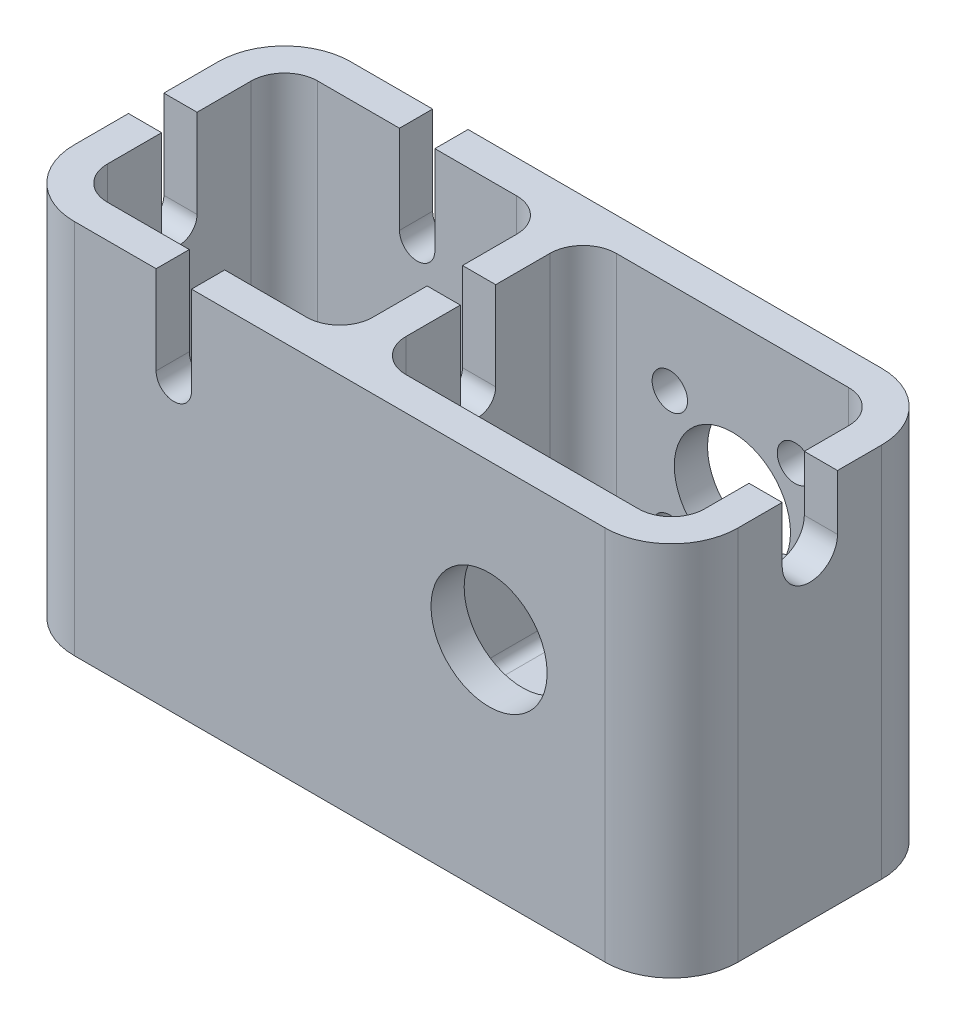
from build123d import *

# Parameters (mm, degrees)
SKETCH1_W           = 60
SKETCH1_H           = 25
BOSS_EXTRUDE1_DEPTH = 4
SKETCH3_R           = 1.6
CUT_EXTRUDE1_DEPTH  = 66.122960621
SKETCH4_W           = 60
SKETCH4_H           = 25
SKETCH4_W_2         = 24
SKETCH4_H_2         = 19
SKETCH4_W_3         = 27
BOSS_EXTRUDE2_DEPTH = 30
SKETCH5_R           = 5.25
CUT_EXTRUDE2_DEPTH  = 74.35529974
CUT_EXTRUDE3_REACH  = 75.355
SKETCH6_R           = 1.6
FILLET3_R           = 3
FILLET4_R           = 1
FILLET5_R           = 6
CUT_EXTRUDE4_DEPTH  = 74.35529974
CUT_EXTRUDE5_REACH  = 75.355
CUT_EXTRUDE6_REACH  = 75.355


with BuildPart() as part:
    # Sketch1 → Boss-Extrude1 (new body)
    with BuildSketch(Plane(origin=(0, 0, 0), x_dir=(1, 0, 0), z_dir=(0, 1, 0))):
        with Locations((30, 12.5)):
            Rectangle(SKETCH1_W, SKETCH1_H)
    extrude(amount=BOSS_EXTRUDE1_DEPTH)

    # Sketch3 → Cut-Extrude1 (cut, through all)
    with BuildSketch(Plane(origin=(0, 4, 0), x_dir=(1, 0, 0), z_dir=(0, 1, 0))):
        with Locations(Location((7.5, 17.5, 0), (0, 0, 270))):
            Circle(SKETCH3_R)
        with Locations(Location((22.5, 17.5, 0), (0, 0, 270))):
            Circle(SKETCH3_R)
        with Locations(Location((22.5, 7.5, 0), (0, 0, 270))):
            Circle(SKETCH3_R)
        with Locations(Location((7.5, 7.5, 0), (0, 0, 270))):
            Circle(SKETCH3_R)
    extrude(amount=-CUT_EXTRUDE1_DEPTH, mode=Mode.SUBTRACT)

    # Sketch4 → Boss-Extrude2 (add)
    with BuildSketch(Plane(origin=(0, 4, 0), x_dir=(1, 0, 0), z_dir=(0, 1, 0))):
        with Locations((30, 12.5)):
            Rectangle(SKETCH4_W, SKETCH4_H)
        with Locations((15, 12.5)):
            Rectangle(SKETCH4_W_2, SKETCH4_H_2, mode=Mode.SUBTRACT)
        with Locations((43.5, 12.5)):
            Rectangle(SKETCH4_W_3, SKETCH4_H_2, mode=Mode.SUBTRACT)
    extrude(amount=BOSS_EXTRUDE2_DEPTH)

    # Sketch5 → Cut-Extrude2 (cut, through all)
    with BuildSketch(Plane(origin=(0, 0, -25), x_dir=(-1, 0, 0), z_dir=(0, 0, -1))):
        with Locations((-43.5, 20)):
            Circle(SKETCH5_R)
    extrude(amount=-CUT_EXTRUDE2_DEPTH, mode=Mode.SUBTRACT)

    # Sketch6 → Cut-Extrude3 (cut, up to next)
    with BuildSketch(Plane(origin=(0, 0, -25), x_dir=(-1, 0, 0), z_dir=(0, 0, -1)), mode=Mode.PRIVATE) as cut_extrude3_sk1:
        with Locations((-37.843145751, 14.343145751)):
            Circle(SKETCH6_R)
    cut_extrude3_tool1 = extrude(cut_extrude3_sk1.sketch, amount=-CUT_EXTRUDE3_REACH, mode=Mode.PRIVATE) & part.part
    # Sketch6 → Cut-Extrude3 (cut, up to next)
    with BuildSketch(Plane(origin=(0, 0, -25), x_dir=(-1, 0, 0), z_dir=(0, 0, -1)), mode=Mode.PRIVATE) as cut_extrude3_sk2:
        with Locations((-49.156854249, 14.343145751)):
            Circle(SKETCH6_R)
    cut_extrude3_tool2 = extrude(cut_extrude3_sk2.sketch, amount=-CUT_EXTRUDE3_REACH, mode=Mode.PRIVATE) & part.part
    # Sketch6 → Cut-Extrude3 (cut, up to next)
    with BuildSketch(Plane(origin=(0, 0, -25), x_dir=(-1, 0, 0), z_dir=(0, 0, -1)), mode=Mode.PRIVATE) as cut_extrude3_sk3:
        with Locations((-49.156854249, 25.656854249)):
            Circle(SKETCH6_R)
    cut_extrude3_tool3 = extrude(cut_extrude3_sk3.sketch, amount=-CUT_EXTRUDE3_REACH, mode=Mode.PRIVATE) & part.part
    # Sketch6 → Cut-Extrude3 (cut, up to next)
    with BuildSketch(Plane(origin=(0, 0, -25), x_dir=(-1, 0, 0), z_dir=(0, 0, -1)), mode=Mode.PRIVATE) as cut_extrude3_sk4:
        with Locations((-37.843145751, 25.656854249)):
            Circle(SKETCH6_R)
    cut_extrude3_tool4 = extrude(cut_extrude3_sk4.sketch, amount=-CUT_EXTRUDE3_REACH, mode=Mode.PRIVATE) & part.part
    add(cut_extrude3_tool1.solids().sort_by_distance((37.843146, 14.343146, -25))[0], mode=Mode.SUBTRACT)
    add(cut_extrude3_tool2.solids().sort_by_distance((49.156854, 14.343146, -25))[0], mode=Mode.SUBTRACT)
    add(cut_extrude3_tool3.solids().sort_by_distance((49.156854, 25.656854, -25))[0], mode=Mode.SUBTRACT)
    add(cut_extrude3_tool4.solids().sort_by_distance((37.843146, 25.656854, -25))[0], mode=Mode.SUBTRACT)

    # Fillet3
    fillet3_edges = [part.edges().sort_by_distance(p)[0] for p in [
        (3, 19, -3),
        (27, 19, -3),
        (27, 19, -22),
        (3, 19, -22),
        (57, 19, -3),
        (57, 19, -22),
        (30, 19, -22),
        (30, 19, -3),
    ]]
    fillet(fillet3_edges, radius=FILLET3_R)

    # Fillet4
    fillet4_edges = [part.edges().sort_by_distance(p)[0] for p in [
        (15, 4, -3),
        (15, 4, -22),
        (3, 4, -12.5),
        (27, 4, -12.5),
        (26.121320344, 4, -21.121320344),
        (3.878679656, 4, -21.121320344),
        (3.878679656, 4, -3.878679656),
        (26.121320344, 4, -3.878679656),
        (30, 4, -12.5),
        (43.5, 4, -3),
        (57, 4, -12.5),
        (43.5, 4, -22),
        (30.878679656, 4, -21.121320344),
        (56.121320344, 4, -21.121320344),
        (56.121320344, 4, -3.878679656),
        (30.878679656, 4, -3.878679656),
    ]]
    fillet(fillet4_edges, radius=FILLET4_R)

    # Fillet5
    fillet5_edges = [part.edges().sort_by_distance(p)[0] for p in [
        (0, 17, -25),
        (60, 17, -25),
        (60, 17, 0),
        (0, 17, 0),
    ]]
    fillet(fillet5_edges, radius=FILLET5_R)

    # Sketch7 → Cut-Extrude4 (cut, through all)
    with BuildSketch(Plane(origin=(0, 0, -25), x_dir=(-1, 0, 0), z_dir=(0, 0, -1))):
        with BuildLine():
            Line((-13.4, 26), (-13.4, 34))
            Line((-13.4, 34), (-16.6, 34))
            Line((-16.6, 34), (-16.6, 26))
            ThreePointArc((-16.6, 26), (-15, 24.4), (-13.4, 26))
        make_face()
    extrude(amount=-CUT_EXTRUDE4_DEPTH, mode=Mode.SUBTRACT)

    # Cut-Extrude5: up to this face of the body (flat: up to its plane)
    cut_extrude5_end = Plane(part.part.faces().sort_by_distance((30, 19.5, -12.5))[0])
    # Sketch8 → Cut-Extrude5 (cut, up to the picked face)
    with BuildSketch(Plane.ZY, mode=Mode.PRIVATE) as cut_extrude5_sk1:
        with BuildLine():
            Line((-14.1, 26), (-14.1, 34))
            Line((-14.1, 34), (-10.9, 34))
            Line((-10.9, 34), (-10.9, 26))
            ThreePointArc((-10.9, 26), (-12.5, 24.4), (-14.1, 26))
        make_face()
    cut_extrude5_tool1 = split(extrude(cut_extrude5_sk1.sketch, amount=-CUT_EXTRUDE5_REACH, mode=Mode.PRIVATE), bisect_by=cut_extrude5_end, keep=Keep.BOTH, mode=Mode.PRIVATE)
    add(cut_extrude5_tool1.solids().sort_by(Axis((0, 29.364793, -12.5), (1, 0, 0)))[0], mode=Mode.SUBTRACT)

    # Sketch9 → Cut-Extrude6 (cut, up to next)
    with BuildSketch(Plane(origin=(60, 0, 0), x_dir=(0, 0, -1), z_dir=(1, 0, 0)), mode=Mode.PRIVATE) as cut_extrude6_sk1:
        with BuildLine():
            Line((15, 29), (15, 34))
            Line((15, 34), (10, 34))
            Line((10, 34), (10, 29))
            ThreePointArc((10, 29), (12.5, 26.5), (15, 29))
        make_face()
    cut_extrude6_tool1 = extrude(cut_extrude6_sk1.sketch, amount=-CUT_EXTRUDE6_REACH, mode=Mode.PRIVATE) & part.part
    add(cut_extrude6_tool1.solids().sort_by_distance((60, 30.495896, -12.5))[0], mode=Mode.SUBTRACT)


solid = part.part
